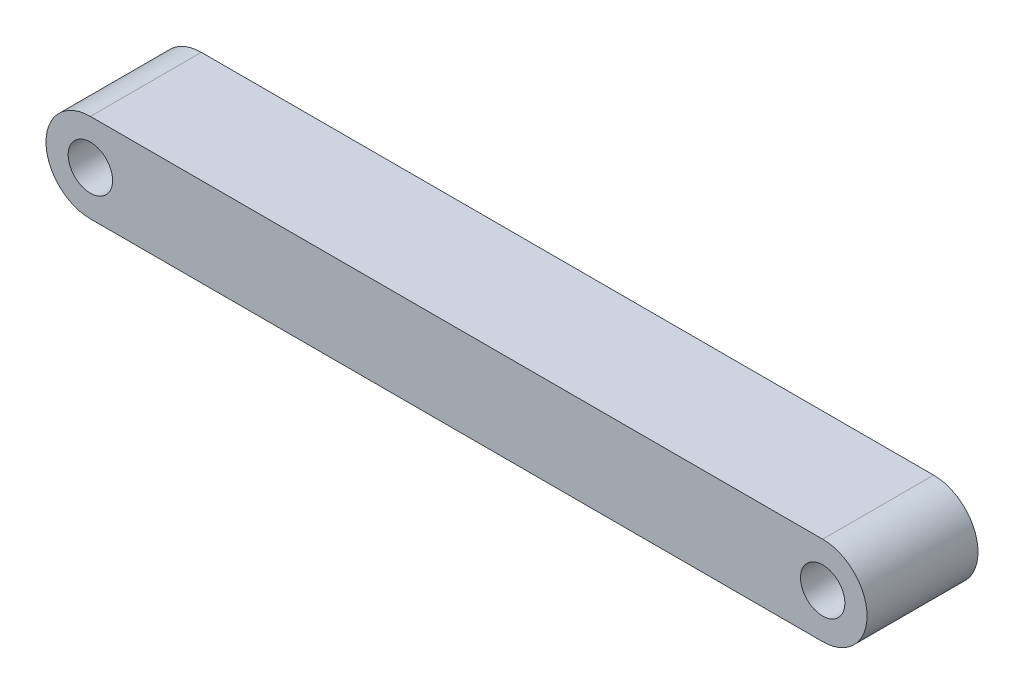
from build123d import *

# Parameters (mm, degrees)
CROQUIS1_R              = 2
SALIENTE_EXTRUIR1_DEPTH = 10


with BuildPart() as part:
    # Croquis1 → Saliente-Extruir1 (new body)
    with BuildSketch(Plane.XY):
        with BuildLine():
            Line((0, 4), (66, 4))
            ThreePointArc((66, 4), (70, 0), (66, -4))
            Line((66, -4), (0, -4))
            ThreePointArc((0, -4), (-4, 0), (0, 4))
        make_face()
        Circle(CROQUIS1_R, mode=Mode.SUBTRACT)
        with Locations((66, 0)):
            Circle(CROQUIS1_R, mode=Mode.SUBTRACT)
    extrude(amount=SALIENTE_EXTRUIR1_DEPTH)


solid = part.part
